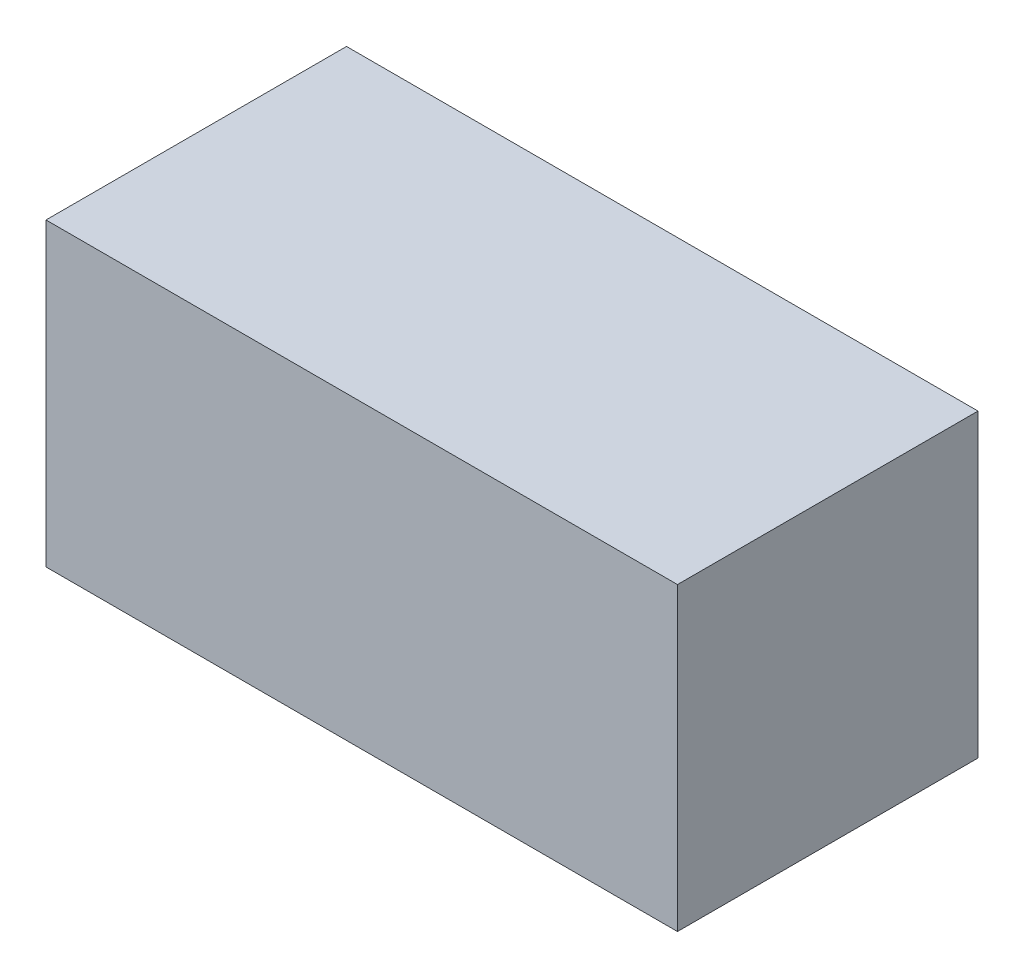
from build123d import *

# Parameters (mm, degrees)
EXTRUDE1_DEPTH      = 2.38125
EXTRUDE1_DEPTH_BACK = 2.38125
SKETCH3_W           = 10.0076
SKETCH3_H           = 4.7625


with BuildPart() as part:
    # Sketch3 → Extrude1 (new, two sides: drawn at the far end of the back side and taken through both)
    with BuildSketch(Plane(origin=(0, 0, 0), x_dir=(1, 0, 0), z_dir=(0, 1, 0)).offset(-EXTRUDE1_DEPTH_BACK)):
        Rectangle(SKETCH3_W, SKETCH3_H)
    extrude(amount=EXTRUDE1_DEPTH + EXTRUDE1_DEPTH_BACK)


solid = part.part
